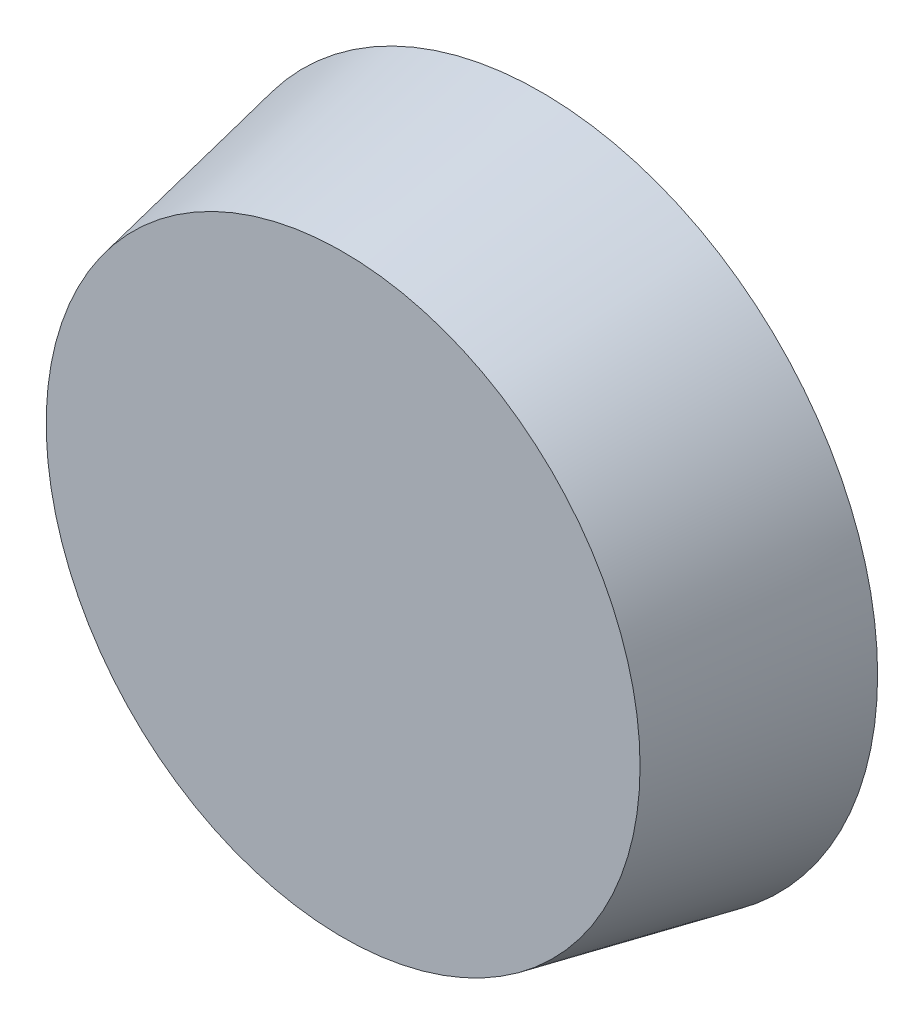
from build123d import *

# Parameters (mm, degrees)
SKETCH1_R = 53.975
SKETCH2_R = 47.625


with BuildPart() as part:
    # Sketch1 → Loft1 section 0
    with BuildSketch(Plane.XY):
        Circle(SKETCH1_R)
    # Sketch2 → Loft1 section 1
    with BuildSketch(Plane.XY.offset(31.75)):
        Circle(SKETCH2_R)
    loft()


solid = part.part
